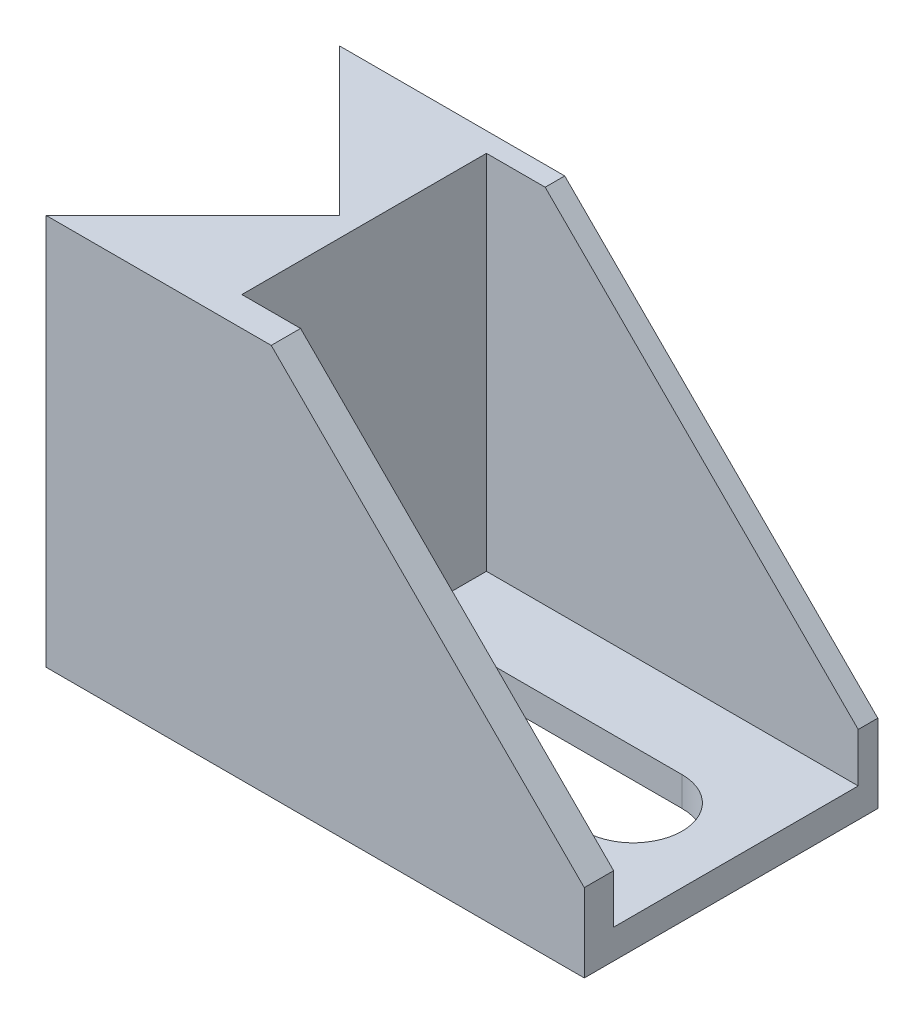
from build123d import *

# Parameters (mm, degrees)
BOSS_EXTRUDE1_DEPTH = 19.05
SHELL1_T            = -1.905
CUT_EXTRUDE1_DEPTH  = 1.905
BOSS_EXTRUDE2_DEPTH = 25.4
CUT_EXTRUDE2_START  = -23.495
SKETCH5_W           = 24.13
SKETCH5_H           = 15.875
CUT_EXTRUDE2_DEPTH  = 23.495


with BuildPart() as part:
    # Sketch1 → Boss-Extrude1 (new body)
    with BuildSketch(Plane.XY):
        Polygon((0, 0), (25.4, 0), (25.4, 5.08), (5.08, 25.4), (0, 25.4), align=None)
    extrude(amount=BOSS_EXTRUDE1_DEPTH)

    # Shell1
    shell1_openings = [part.faces().sort_by_distance(p)[0] for p in [
        (15.24, 15.24, 9.525),
    ]]
    offset(amount=SHELL1_T, openings=shell1_openings, kind=Kind.INTERSECTION)

    # Sketch2 → Cut-Extrude1 (cut)
    with BuildSketch(Plane.XZ):
        with BuildLine():
            Line((6.35, 12.7), (19.05, 12.7))
            ThreePointArc((19.05, 12.7), (22.225, 9.525), (19.05, 6.35))
            Line((19.05, 6.35), (6.35, 6.35))
            ThreePointArc((6.35, 6.35), (3.175, 9.525), (6.35, 12.7))
        make_face()
    extrude(amount=-CUT_EXTRUDE1_DEPTH, mode=Mode.SUBTRACT)

    # Sketch3 → Boss-Extrude2 (add)
    with BuildSketch(Plane(origin=(0, 25.4, 0), x_dir=(1, 0, 0), z_dir=(0, 1, 0))):
        Polygon((-9.525, 0), (0, -9.525), (0, 0), align=None)
        Polygon((0, -19.05), (0, -9.525), (-9.525, -19.05), align=None)
    extrude(amount=-BOSS_EXTRUDE2_DEPTH)

    # Sketch5 → Cut-Extrude2 (cut)
    with BuildSketch(Plane(origin=(0, 25.4, 0), x_dir=(1, 0, 0), z_dir=(0, 1, 0)).offset(CUT_EXTRUDE2_START)):
        with Locations((13.335, -9.2075)):
            Rectangle(SKETCH5_W, SKETCH5_H)
    extrude(amount=CUT_EXTRUDE2_DEPTH, mode=Mode.SUBTRACT)


solid = part.part
